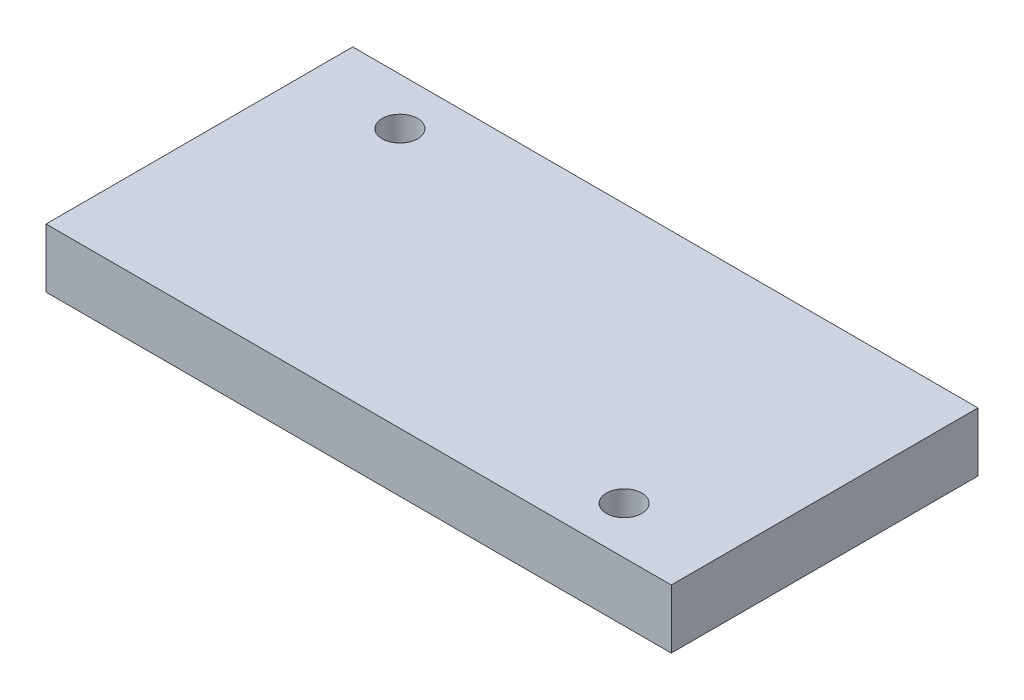
from build123d import *

# Parameters (mm, degrees)
SCHIZZO1_W                   = 53
SCHIZZO1_H                   = 26
ESTRUSIONE_ESTRUSIONE1_DEPTH = 5
SCHIZZO2_R                   = 1.5
TAGLIO_ESTRUSIONE1_DEPTH     = 13


with BuildPart() as part:
    # Schizzo1 → Estrusione-Estrusione1 (new body)
    with BuildSketch(Plane(origin=(0, 0, 0), x_dir=(1, 0, 0), z_dir=(0, 1, 0))):
        Rectangle(SCHIZZO1_W, SCHIZZO1_H)
    extrude(amount=ESTRUSIONE_ESTRUSIONE1_DEPTH)

    # Schizzo2 → Taglio-Estrusione1 (cut)
    with BuildSketch(Plane(origin=(0, 5, 0), x_dir=(1, 0, 0), z_dir=(0, 1, 0))):
        with Locations(Location((-18.5, 9, 0), (0, 0, 270))):
            Circle(SCHIZZO2_R)
        with Locations(Location((18.5, -9, 0), (0, 0, 270))):
            Circle(SCHIZZO2_R)
    extrude(amount=-TAGLIO_ESTRUSIONE1_DEPTH, mode=Mode.SUBTRACT)


solid = part.part
